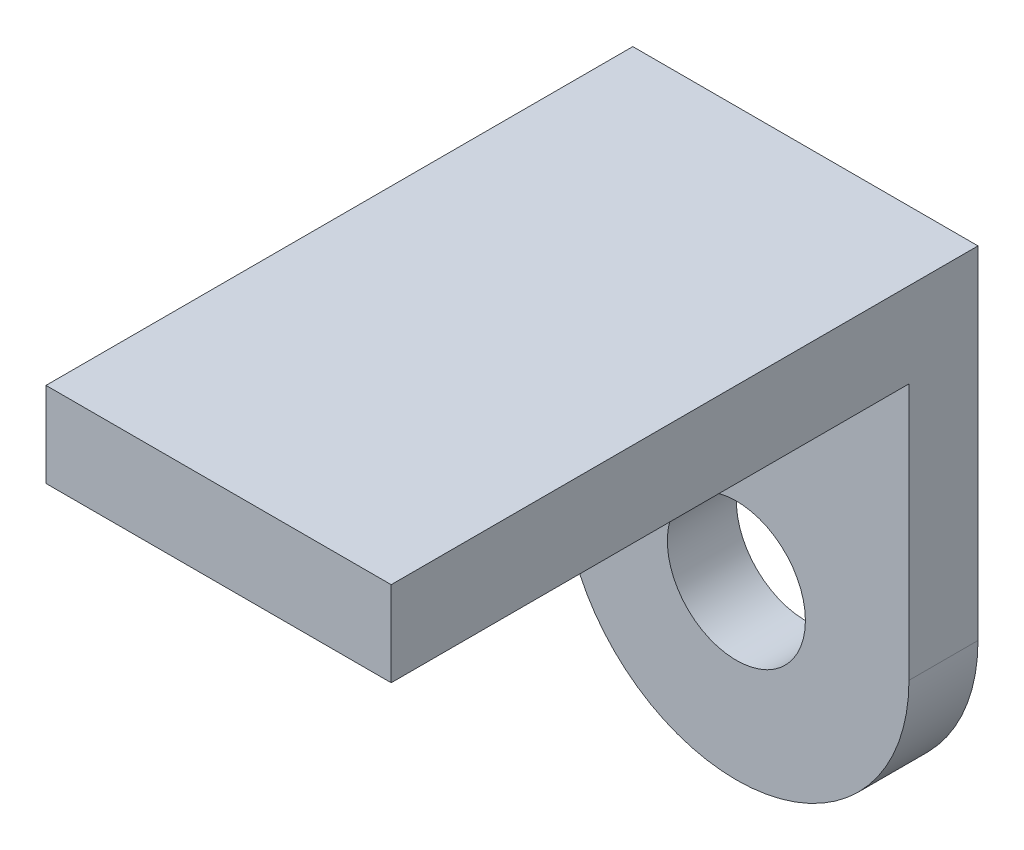
from build123d import *

# Parameters (mm, degrees)
SCHIZZO1_R                   = 2
ESTRUSIONE_ESTRUSIONE1_DEPTH = 2
SCHIZZO2_W                   = 10
SCHIZZO2_H                   = 2.461564046
ESTRUSIONE_ESTRUSIONE2_DEPTH = 15
SCHIZZO4_W                   = 0.358974359
SCHIZZO4_H                   = 1.346153846
ESTRUSIONE_ESTRUSIONE3_DEPTH = 0.2


with BuildPart() as part:
    # Schizzo1 → Estrusione-Estrusione1 (new body)
    with BuildSketch(Plane.XY):
        with BuildLine():
            Line((-5, 0), (-5, 9.9))
            Line((-5, 9.9), (5, 9.9))
            Line((5, 9.9), (5, 0))
            ThreePointArc((5, 0), (0, -5), (-5, 0))
        make_face()
        Circle(SCHIZZO1_R, mode=Mode.SUBTRACT)
    extrude(amount=ESTRUSIONE_ESTRUSIONE1_DEPTH)

    # Schizzo2 → Estrusione-Estrusione2 (add)
    with BuildSketch(Plane.XY.offset(2)):
        with Locations((0, 8.669217977)):
            Rectangle(SCHIZZO2_W, SCHIZZO2_H)
    extrude(amount=ESTRUSIONE_ESTRUSIONE2_DEPTH)

    # Schizzo4 → Estrusione-Estrusione3 (add)
    # profile 1 of 6: a face of its own
    with BuildSketch(Plane.XZ.offset(-7.438435954)):
        with BuildLine():
            Line((3.5, 16.320512821), (3.5, 15.634114583))
            add(Edge.make_bspline(
                [(3.5, 15.634114583), (3.499948104, 15.586903677), (3.499848668, 15.496445484), (3.496833922, 15.366730429), (3.49280723, 15.248920697), (3.487225337, 15.143270316), (3.480628747, 15.049454218), (3.471376708, 14.967896918), (3.461716412, 14.897957362), (3.451895005, 14.856050913), (3.447415865, 14.836939103)],
                knots=[0, 0, 0, 0, 1.415646017, 2.712440637, 3.8905458, 4.950247383, 5.884950622, 6.709939814, 7.411656543, 8, 8, 8, 8], degree=3))
            add(Edge.make_bspline(
                [(3.447415865, 14.836939103), (3.440793975, 14.812745512), (3.42770623, 14.764928422), (3.401491651, 14.696028205), (3.370412659, 14.630471292), (3.334976989, 14.568051074), (3.293734792, 14.509467066), (3.247990678, 14.453969355), (3.197769812, 14.401239622), (3.142098627, 14.35306908), (3.083029703, 14.308721911), (3.019247543, 14.270678768), (2.952140341, 14.238499291), (2.881020836, 14.212218459), (2.806321276, 14.192234889), (2.727823588, 14.177470397), (2.645797497, 14.168023892), (2.589736435, 14.167124508), (2.561197917, 14.166666667)],
                knots=[0, 0, 0, 0, 0.999487232, 1.975422798, 2.933948774, 3.889618007, 4.832992075, 5.786114792, 6.754729845, 7.731954186, 8.717668599, 9.695514499, 10.68728626, 11.680675814, 12.71351902, 13.766008651, 14.862761406, 16, 16, 16, 16], degree=3))
            add(Edge.make_bspline(
                [(2.561197917, 14.166666667), (2.53242014, 14.167088091), (2.476114476, 14.167912637), (2.393741688, 14.177808923), (2.315023298, 14.191139114), (2.240133847, 14.211636167), (2.169518077, 14.23848184), (2.102096845, 14.269973893), (2.039017173, 14.307957423), (1.980050055, 14.351602253), (1.925140143, 14.400153847), (1.874685348, 14.453406785), (1.82898101, 14.511146078), (1.787924666, 14.573188226), (1.752468387, 14.640138075), (1.720711082, 14.710980228), (1.694040021, 14.786330445), (1.68000996, 14.838472959), (1.672876603, 14.864983974)],
                knots=[0, 0, 0, 0, 1.121902311, 2.195077645, 3.232258892, 4.234102512, 5.217864754, 6.176164875, 7.132989551, 8.084763148, 9.034132444, 9.988522005, 10.94243251, 11.903244335, 12.886203696, 13.894208494, 14.929344452, 16, 16, 16, 16], degree=3))
            add(Edge.make_bspline(
                [(1.672876603, 14.864983974), (1.668213621, 14.886911308), (1.657994427, 14.934966336), (1.64658597, 15.014109058), (1.63684837, 15.106254444), (1.629547232, 15.211276724), (1.623296864, 15.329081629), (1.61832877, 15.459732886), (1.615598916, 15.603486963), (1.615458123, 15.703758207), (1.615384615, 15.756109776)],
                knots=[0, 0, 0, 0, 0.601384939, 1.31797006, 2.144135048, 3.087295005, 4.142315834, 5.309527816, 6.595305764, 8, 8, 8, 8], degree=3))
            Line((1.615384615, 15.756109776), (1.615384615, 16.006410256))
            Line((1.615384615, 16.006410256), (0, 16.006410256))
            Line((0, 16.006410256), (0, 16.320512821))
            Line((0, 16.320512821), (3.5, 16.320512821))
        make_face()
        with BuildLine():
            Line((3.141025641, 16.006410256), (1.974358974, 16.006410256))
            Line((1.974358974, 16.006410256), (1.966646635, 15.393629808))
            add(Edge.make_bspline(
                [(1.966646635, 15.393629808), (1.966627924, 15.363709589), (1.966591804, 15.305949225), (1.970631709, 15.222283895), (1.975087995, 15.144860897), (1.982066731, 15.073512095), (1.99126187, 15.008782741), (2.001270604, 14.949841409), (2.014830447, 14.897550968), (2.033737491, 14.836276146), (2.065355346, 14.76822905), (2.112432024, 14.694692519), (2.170792088, 14.631362577), (2.237310672, 14.576925738), (2.311578922, 14.534737331), (2.390418136, 14.503006271), (2.473877922, 14.48452311), (2.530961719, 14.482029031), (2.559795673, 14.480769231)],
                knots=[0, 0, 0, 0, 1.160368111, 2.240066715, 3.248291599, 4.168343349, 5.019594299, 5.784185847, 6.485545725, 7.113397927, 8.269509094, 9.383373363, 10.487084095, 11.595623793, 12.704274681, 13.786671823, 14.88201193, 16, 16, 16, 16], degree=3))
            add(Edge.make_bspline(
                [(2.559795673, 14.480769231), (2.587932, 14.482035758), (2.643863535, 14.484553458), (2.725874557, 14.503152064), (2.803877317, 14.534675389), (2.877231232, 14.577211613), (2.943477588, 14.630085397), (3.000520555, 14.692011888), (3.047000556, 14.761726588), (3.076793746, 14.826609774), (3.095014888, 14.884205845), (3.107758306, 14.934239045), (3.117934363, 14.990729327), (3.126173726, 15.053697228), (3.133227231, 15.122654024), (3.138013195, 15.198192351), (3.140814655, 15.28002599), (3.14095361, 15.336836562), (3.141025641, 15.366286058)],
                knots=[0, 0, 0, 0, 1.120550889, 2.227516482, 3.330715807, 4.461473166, 5.594337325, 6.694900473, 7.802844763, 8.919519911, 9.52614448, 10.208195984, 10.975273469, 11.811520316, 12.738076669, 13.736566072, 14.826679847, 16, 16, 16, 16], degree=3))
            Line((3.141025641, 15.366286058), (3.141025641, 16.006410256))
        make_face(mode=Mode.SUBTRACT)
    # profile 2 of 6: a face of its own
    with BuildSketch(Plane.XZ.offset(-7.438435954)):
        Polygon((3.141025641, 13.852564103), (3.5, 13.852564103), (3.5, 12.012820513), (3.141025641, 12.012820513), (3.141025641, 12.775641026), (0, 12.775641026), (0, 13.08974359), (3.141025641, 13.08974359), align=None)
    # profile 3 of 6: a face of its own
    with BuildSketch(Plane.XZ.offset(-7.438435954)):
        with Locations((1.346153847, 11.025641026)):
            Rectangle(SCHIZZO4_W, SCHIZZO4_H)
    # profile 4 of 6: a face of its own
    with BuildSketch(Plane.XZ.offset(-7.438435954)):
        with BuildLine():
            add(Edge.make_bspline(
                [(1.748597756, 10.083333333), (1.804695144, 10.083005315), (1.913665128, 10.082368135), (2.07244977, 10.075279714), (2.22141006, 10.063504373), (2.360553124, 10.047366997), (2.489914896, 10.027729025), (2.609149627, 10.00151351), (2.718809322, 9.971700804), (2.819251073, 9.937148033), (2.9118298, 9.898161364), (2.99825139, 9.855723155), (3.078406126, 9.80817236), (3.153498145, 9.758145399), (3.222689384, 9.703814153), (3.285848812, 9.645751683), (3.343014566, 9.583382033), (3.394867016, 9.517938733), (3.440037109, 9.449008199), (3.480738366, 9.378715329), (3.514144377, 9.305819749), (3.541593396, 9.23098629), (3.5635876, 9.154432576), (3.578818544, 9.075842292), (3.588364251, 8.995196451), (3.589279448, 8.940765628), (3.58974359, 8.913161058)],
                knots=[0, 0, 0, 0, 1.646377244, 3.198111528, 4.663803227, 6.031090796, 7.308794487, 8.502186765, 9.612154809, 10.642545331, 11.617106989, 12.558866172, 13.465886467, 14.35053239, 15.20542558, 16.045215227, 16.865619885, 17.686225247, 18.492864914, 19.282407821, 20.068097601, 20.842842034, 21.620163247, 22.403093475, 23.190129512, 24, 24, 24, 24], degree=3))
            add(Edge.make_bspline(
                [(3.58974359, 8.913161058), (3.589255775, 8.885325579), (3.588285664, 8.82996957), (3.578961721, 8.748129195), (3.563490598, 8.668179513), (3.541569623, 8.590461375), (3.514373947, 8.514336388), (3.48028683, 8.440399981), (3.440607962, 8.368192899), (3.393984085, 8.298862611), (3.342001809, 8.231647996), (3.28323914, 8.168200033), (3.218289421, 8.108512947), (3.147847557, 8.051837642), (3.070562472, 7.999782045), (2.987778362, 7.950208612), (2.898047497, 7.905836576), (2.80286703, 7.863101901), (2.699603371, 7.826214915), (2.58883861, 7.792948669), (2.469264423, 7.766069701), (2.341508178, 7.743680428), (2.205100695, 7.726335532), (2.060334379, 7.71370289), (1.907113989, 7.707029805), (1.80235614, 7.705773104), (1.748597756, 7.705128205)],
                knots=[0, 0, 0, 0, 0.810914788, 1.612654377, 2.396697861, 3.181598691, 3.963628158, 4.749916497, 5.551656086, 6.361998678, 7.18212741, 8.025565596, 8.878627764, 9.750805457, 10.657531673, 11.591944965, 12.560506719, 13.57287815, 14.630710178, 15.753379473, 16.941251878, 18.199788006, 19.531962791, 20.947069417, 22.433333509, 24, 24, 24, 24], degree=3))
            add(Edge.make_bspline(
                [(1.748597756, 7.705128205), (1.695074049, 7.705780595), (1.590785287, 7.70705175), (1.438251546, 7.713619331), (1.294263217, 7.726617051), (1.15841949, 7.74269318), (1.031526912, 7.765593404), (0.91237889, 7.791626923), (0.802003651, 7.823983793), (0.699284596, 7.860368008), (0.604570451, 7.902175383), (0.515615267, 7.946939586), (0.432898706, 7.996208726), (0.355614745, 8.048574771), (0.284561967, 8.104768343), (0.219564768, 8.164708169), (0.16066602, 8.228439871), (0.107973503, 8.295806452), (0.061892361, 8.366227402), (0.020703231, 8.438193466), (-0.012719194, 8.51314102), (-0.040938395, 8.589404416), (-0.062909799, 8.667703249), (-0.077953472, 8.747960718), (-0.088533415, 8.829913983), (-0.089338801, 8.885315949), (-0.08974359, 8.913161058)],
                knots=[0, 0, 0, 0, 1.56130642, 3.042141888, 4.451772327, 5.777565838, 7.030558081, 8.211376819, 9.333164717, 10.383253789, 11.387583522, 12.350962576, 13.286244149, 14.193812918, 15.072134482, 15.925989337, 16.770211267, 17.600669898, 18.417446232, 19.22325363, 20.01647746, 20.807971184, 21.593601364, 22.38506573, 23.188331689, 24, 24, 24, 24], degree=3))
            add(Edge.make_bspline(
                [(-0.08974359, 8.913161058), (-0.089274982, 8.940764506), (-0.088350978, 8.995193119), (-0.078869784, 9.075855157), (-0.063409151, 9.154322872), (-0.042413687, 9.230753126), (-0.015729699, 9.305302334), (0.018211346, 9.377240214), (0.057577679, 9.447516818), (0.102364248, 9.515811471), (0.153688491, 9.580822518), (0.210451579, 9.642922435), (0.274077246, 9.700543222), (0.343547066, 9.754193525), (0.418271588, 9.805104748), (0.498986903, 9.85218958), (0.586218212, 9.894545011), (0.679308003, 9.934405404), (0.780487951, 9.969542265), (0.890732526, 10.000345232), (1.010651574, 10.026023814), (1.139889093, 10.046674663), (1.278541811, 10.06369921), (1.426853853, 10.075223956), (1.58469726, 10.08237378), (1.69296729, 10.083007646), (1.748597756, 10.083333333)],
                knots=[0, 0, 0, 0, 0.810940842, 1.599017053, 2.38298203, 3.159479784, 3.926441347, 4.70693857, 5.494146311, 6.292334103, 7.104379492, 7.925868426, 8.762126819, 9.623561095, 10.503686106, 11.41783325, 12.366995289, 13.351843594, 14.392337808, 15.512229747, 16.713911458, 17.994391108, 19.357476964, 20.818259213, 22.365182633, 24, 24, 24, 24], degree=3))
        make_face()
        with BuildLine():
            add(Edge.make_bspline(
                [(1.75, 9.769230769), (1.703251301, 9.769111322), (1.612521256, 9.768879499), (1.480677996, 9.762823298), (1.357707666, 9.754573067), (1.243454132, 9.743931767), (1.138304111, 9.728128828), (1.041534456, 9.710422009), (0.953657127, 9.688874022), (0.874069619, 9.663378666), (0.801419519, 9.634340719), (0.733821907, 9.602630841), (0.670457219, 9.568584325), (0.611969031, 9.53041457), (0.557775133, 9.488987349), (0.508031265, 9.444234635), (0.462954472, 9.396235135), (0.409466486, 9.329788093), (0.353539978, 9.242497624), (0.30543891, 9.131950789), (0.275014831, 9.018309403), (0.271156555, 8.94115459), (0.269230769, 8.902644231)],
                knots=[0, 0, 0, 0, 1.459116078, 2.831857795, 4.118796693, 5.306371758, 6.412361096, 7.436813035, 8.376339383, 9.234574298, 10.043323891, 10.816788787, 11.564361537, 12.286735248, 12.994408768, 13.691741332, 14.372975427, 15.047457468, 16.352811911, 17.594285292, 18.799233213, 20, 20, 20, 20], degree=3))
            add(Edge.make_bspline(
                [(0.269230769, 8.902644231), (0.27082855, 8.863886559), (0.274020813, 8.786451236), (0.30481955, 8.673317441), (0.35128909, 8.563487171), (0.406236595, 8.47741523), (0.458564925, 8.411932687), (0.503179573, 8.365015697), (0.55313544, 8.321953648), (0.607034736, 8.281111574), (0.66590722, 8.243652498), (0.729469796, 8.20958936), (0.797898973, 8.178506013), (0.845668713, 8.160796967), (0.870092147, 8.151742788)],
                knots=[0, 0, 0, 0, 1.353760809, 2.704726607, 4.075137775, 5.516104923, 6.260822281, 7.007110065, 7.778089737, 8.566572457, 9.372053459, 10.217411131, 11.088608312, 12, 12, 12, 12], degree=3))
            add(Edge.make_bspline(
                [(0.870092147, 8.151742788), (0.901321887, 8.141191021), (0.964731651, 8.119766407), (1.063095303, 8.092154633), (1.166298067, 8.070409233), (1.273723184, 8.050845868), (1.386162885, 8.037492812), (1.503269269, 8.026744998), (1.625130631, 8.020414311), (1.707925622, 8.01962956), (1.75, 8.019230769)],
                knots=[0, 0, 0, 0, 0.884706709, 1.796334032, 2.740027952, 3.714592787, 4.726048262, 5.777819803, 6.87074269, 8, 8, 8, 8], degree=3))
            add(Edge.make_bspline(
                [(1.75, 8.019230769), (1.792073473, 8.019670593), (1.874388363, 8.020531089), (1.99481512, 8.026184628), (2.109394462, 8.035269394), (2.218230331, 8.047565425), (2.321129012, 8.064445276), (2.418237752, 8.084716297), (2.50953037, 8.108481743), (2.595242303, 8.135741418), (2.675065479, 8.166462694), (2.74917369, 8.200400493), (2.817959812, 8.236616723), (2.881226403, 8.27596035), (2.939259034, 8.317955684), (2.990893606, 8.363713322), (3.03773058, 8.411417672), (3.091193147, 8.478234865), (3.145704844, 8.565709151), (3.195870603, 8.6745548), (3.224678896, 8.787825444), (3.228740583, 8.864398898), (3.230769231, 8.902644231)],
                knots=[0, 0, 0, 0, 1.313668642, 2.570134578, 3.763346207, 4.902004944, 5.98888779, 7.017888835, 7.998425394, 8.933058446, 9.82474457, 10.667209444, 11.476765193, 12.250262638, 12.991704352, 13.7104269, 14.401925311, 15.076585796, 16.378385137, 17.609787933, 18.806186071, 20, 20, 20, 20], degree=3))
            add(Edge.make_bspline(
                [(3.230769231, 8.902644231), (3.228740401, 8.941356448), (3.224679046, 9.018851408), (3.195946146, 9.133274739), (3.146171898, 9.242895747), (3.090841129, 9.329668235), (3.038677018, 9.396401125), (2.993314909, 9.443523863), (2.943420558, 9.487578716), (2.889456104, 9.529040451), (2.830938416, 9.567173461), (2.767582943, 9.601233911), (2.699979049, 9.632925586), (2.627345478, 9.662025877), (2.547637987, 9.687284956), (2.460204166, 9.709861914), (2.363344124, 9.72755799), (2.257900132, 9.743000336), (2.143506144, 9.754774249), (2.020252311, 9.762802119), (1.888181051, 9.768890457), (1.796982876, 9.76911506), (1.75, 9.769230769)],
                knots=[0, 0, 0, 0, 1.207964612, 2.418129846, 3.655795183, 4.951004962, 5.620895151, 6.296795572, 6.989224116, 7.696855977, 8.419187164, 9.166715907, 9.940135271, 10.748837255, 11.607021648, 12.548275234, 13.5654991, 14.678641405, 15.874140913, 17.15372626, 18.533675393, 20, 20, 20, 20], degree=3))
        make_face(mode=Mode.SUBTRACT)
    # profile 5 of 6: a face of its own
    with BuildSketch(Plane.XZ.offset(-7.438435954)):
        with BuildLine():
            add(Edge.make_bspline(
                [(1.748597756, 7.391025641), (1.804695144, 7.390697623), (1.913665128, 7.390060443), (2.07244977, 7.382972022), (2.22141006, 7.37119668), (2.360553124, 7.355059305), (2.489914896, 7.335421333), (2.609149627, 7.309205818), (2.718809322, 7.279393112), (2.819251073, 7.244840341), (2.9118298, 7.205853671), (2.99825139, 7.163415462), (3.078406126, 7.115864668), (3.153498145, 7.065837706), (3.222689384, 7.011506461), (3.285848812, 6.953443991), (3.343014566, 6.891074341), (3.394867016, 6.82563104), (3.440037109, 6.756700506), (3.480738366, 6.686407637), (3.514144377, 6.613512057), (3.541593396, 6.538678598), (3.5635876, 6.462124883), (3.578818544, 6.383534599), (3.588364251, 6.302888759), (3.589279448, 6.248457935), (3.58974359, 6.220853365)],
                knots=[0, 0, 0, 0, 1.646377244, 3.198111528, 4.663803227, 6.031090796, 7.308794487, 8.502186765, 9.612154809, 10.642545331, 11.617106989, 12.558866172, 13.465886467, 14.35053239, 15.20542558, 16.045215227, 16.865619885, 17.686225247, 18.492864914, 19.282407821, 20.068097601, 20.842842034, 21.620163247, 22.403093475, 23.190129512, 24, 24, 24, 24], degree=3))
            add(Edge.make_bspline(
                [(3.58974359, 6.220853365), (3.589255775, 6.193017887), (3.588285664, 6.137661878), (3.578961721, 6.055821503), (3.563490598, 5.975871821), (3.541569623, 5.898153682), (3.514373947, 5.822028696), (3.48028683, 5.748092288), (3.440607962, 5.675885207), (3.393984085, 5.606554919), (3.342001809, 5.539340304), (3.28323914, 5.475892341), (3.218289421, 5.416205255), (3.147847557, 5.359529949), (3.070562472, 5.307474352), (2.987778362, 5.25790092), (2.898047497, 5.213528884), (2.80286703, 5.170794209), (2.699603371, 5.133907222), (2.58883861, 5.100640977), (2.469264423, 5.073762008), (2.341508178, 5.051372736), (2.205100695, 5.03402784), (2.060334379, 5.021395198), (1.907113989, 5.014722113), (1.80235614, 5.013465412), (1.748597756, 5.012820513)],
                knots=[0, 0, 0, 0, 0.810914788, 1.612654377, 2.396697861, 3.181598691, 3.963628158, 4.749916497, 5.551656086, 6.361998678, 7.18212741, 8.025565596, 8.878627764, 9.750805457, 10.657531673, 11.591944965, 12.560506719, 13.57287815, 14.630710178, 15.753379473, 16.941251878, 18.199788006, 19.531962791, 20.947069417, 22.433333509, 24, 24, 24, 24], degree=3))
            add(Edge.make_bspline(
                [(1.748597756, 5.012820513), (1.695074049, 5.013472903), (1.590785287, 5.014744058), (1.438251546, 5.021311638), (1.294263217, 5.034309359), (1.15841949, 5.050385488), (1.031526912, 5.073285712), (0.91237889, 5.099319231), (0.802003651, 5.1316761), (0.699284596, 5.168060316), (0.604570451, 5.209867691), (0.515615267, 5.254631893), (0.432898706, 5.303901034), (0.355614745, 5.356267079), (0.284561967, 5.412460651), (0.219564768, 5.472400477), (0.16066602, 5.536132179), (0.107973503, 5.603498759), (0.061892361, 5.67391971), (0.020703231, 5.745885773), (-0.012719194, 5.820833327), (-0.040938395, 5.897096723), (-0.062909799, 5.975395556), (-0.077953472, 6.055653025), (-0.088533415, 6.13760629), (-0.089338801, 6.193008257), (-0.08974359, 6.220853365)],
                knots=[0, 0, 0, 0, 1.56130642, 3.042141888, 4.451772327, 5.777565838, 7.030558081, 8.211376819, 9.333164717, 10.383253789, 11.387583522, 12.350962576, 13.286244149, 14.193812918, 15.072134482, 15.925989337, 16.770211267, 17.600669898, 18.417446232, 19.22325363, 20.01647746, 20.807971184, 21.593601364, 22.38506573, 23.188331689, 24, 24, 24, 24], degree=3))
            add(Edge.make_bspline(
                [(-0.08974359, 6.220853365), (-0.089274982, 6.248456814), (-0.088350978, 6.302885426), (-0.078869784, 6.383547465), (-0.063409151, 6.46201518), (-0.042413687, 6.538445433), (-0.015729699, 6.612994642), (0.018211346, 6.684932522), (0.057577679, 6.755209126), (0.102364248, 6.823503779), (0.153688491, 6.888514826), (0.210451579, 6.950614743), (0.274077246, 7.00823553), (0.343547066, 7.061885832), (0.418271588, 7.112797056), (0.498986903, 7.159881888), (0.586218212, 7.202237319), (0.679308003, 7.242097712), (0.780487951, 7.277234573), (0.890732526, 7.30803754), (1.010651574, 7.333716122), (1.139889093, 7.35436697), (1.278541811, 7.371391517), (1.426853853, 7.382916264), (1.58469726, 7.390066088), (1.69296729, 7.390699953), (1.748597756, 7.391025641)],
                knots=[0, 0, 0, 0, 0.810940842, 1.599017053, 2.38298203, 3.159479784, 3.926441347, 4.70693857, 5.494146311, 6.292334103, 7.104379492, 7.925868426, 8.762126819, 9.623561095, 10.503686106, 11.41783325, 12.366995289, 13.351843594, 14.392337808, 15.512229747, 16.713911458, 17.994391108, 19.357476964, 20.818259213, 22.365182633, 24, 24, 24, 24], degree=3))
        make_face()
        with BuildLine():
            add(Edge.make_bspline(
                [(1.75, 7.076923077), (1.703251301, 7.07680363), (1.612521256, 7.076571807), (1.480677996, 7.070515606), (1.357707666, 7.062265375), (1.243454132, 7.051624075), (1.138304111, 7.035821135), (1.041534456, 7.018114317), (0.953657127, 6.996566329), (0.874069619, 6.971070974), (0.801419519, 6.942033026), (0.733821907, 6.910323149), (0.670457219, 6.876276633), (0.611969031, 6.838106878), (0.557775133, 6.796679657), (0.508031265, 6.751926943), (0.462954472, 6.703927443), (0.409466486, 6.637480401), (0.353539978, 6.550189932), (0.30543891, 6.439643097), (0.275014831, 6.326001711), (0.271156555, 6.248846897), (0.269230769, 6.210336538)],
                knots=[0, 0, 0, 0, 1.459116078, 2.831857795, 4.118796693, 5.306371758, 6.412361096, 7.436813035, 8.376339383, 9.234574298, 10.043323891, 10.816788787, 11.564361537, 12.286735248, 12.994408768, 13.691741332, 14.372975427, 15.047457468, 16.352811911, 17.594285292, 18.799233213, 20, 20, 20, 20], degree=3))
            add(Edge.make_bspline(
                [(0.269230769, 6.210336538), (0.27082855, 6.171578867), (0.274020813, 6.094143544), (0.30481955, 5.981009748), (0.35128909, 5.871179478), (0.406236595, 5.785107538), (0.458564925, 5.719624995), (0.503179573, 5.672708005), (0.55313544, 5.629645956), (0.607034736, 5.588803881), (0.66590722, 5.551344806), (0.729469796, 5.517281668), (0.797898973, 5.48619832), (0.845668713, 5.468489274), (0.870092147, 5.459435096)],
                knots=[0, 0, 0, 0, 1.353760809, 2.704726607, 4.075137775, 5.516104923, 6.260822281, 7.007110065, 7.778089737, 8.566572457, 9.372053459, 10.217411131, 11.088608312, 12, 12, 12, 12], degree=3))
            add(Edge.make_bspline(
                [(0.870092147, 5.459435096), (0.901321887, 5.448883328), (0.964731651, 5.427458715), (1.063095303, 5.39984694), (1.166298067, 5.378101541), (1.273723184, 5.358538175), (1.386162885, 5.345185119), (1.503269269, 5.334437306), (1.625130631, 5.328106619), (1.707925622, 5.327321868), (1.75, 5.326923077)],
                knots=[0, 0, 0, 0, 0.884706709, 1.796334032, 2.740027952, 3.714592787, 4.726048262, 5.777819803, 6.87074269, 8, 8, 8, 8], degree=3))
            add(Edge.make_bspline(
                [(1.75, 5.326923077), (1.792073473, 5.327362901), (1.874388363, 5.328223397), (1.99481512, 5.333876935), (2.109394462, 5.342961701), (2.218230331, 5.355257733), (2.321129012, 5.372137583), (2.418237752, 5.392408604), (2.50953037, 5.41617405), (2.595242303, 5.443433725), (2.675065479, 5.474155002), (2.74917369, 5.508092801), (2.817959812, 5.54430903), (2.881226403, 5.583652657), (2.939259034, 5.625647991), (2.990893606, 5.671405629), (3.03773058, 5.71910998), (3.091193147, 5.785927173), (3.145704844, 5.873401459), (3.195870603, 5.982247107), (3.224678896, 6.095517751), (3.228740583, 6.172091206), (3.230769231, 6.210336538)],
                knots=[0, 0, 0, 0, 1.313668642, 2.570134578, 3.763346207, 4.902004944, 5.98888779, 7.017888835, 7.998425394, 8.933058446, 9.82474457, 10.667209444, 11.476765193, 12.250262638, 12.991704352, 13.7104269, 14.401925311, 15.076585796, 16.378385137, 17.609787933, 18.806186071, 20, 20, 20, 20], degree=3))
            add(Edge.make_bspline(
                [(3.230769231, 6.210336538), (3.228740401, 6.249048756), (3.224679046, 6.326543715), (3.195946146, 6.440967047), (3.146171898, 6.550588054), (3.090841129, 6.637360543), (3.038677018, 6.704093433), (2.993314909, 6.75121617), (2.943420558, 6.795271023), (2.889456104, 6.836732758), (2.830938416, 6.874865769), (2.767582943, 6.908926218), (2.699979049, 6.940617894), (2.627345478, 6.969718184), (2.547637987, 6.994977264), (2.460204166, 7.017554222), (2.363344124, 7.035250298), (2.257900132, 7.050692644), (2.143506144, 7.062466557), (2.020252311, 7.070494427), (1.888181051, 7.076582764), (1.796982876, 7.076807367), (1.75, 7.076923077)],
                knots=[0, 0, 0, 0, 1.207964612, 2.418129846, 3.655795183, 4.951004962, 5.620895151, 6.296795572, 6.989224116, 7.696855977, 8.419187164, 9.166715907, 9.940135271, 10.748837255, 11.607021648, 12.548275234, 13.5654991, 14.678641405, 15.874140913, 17.15372626, 18.533675393, 20, 20, 20, 20], degree=3))
        make_face(mode=Mode.SUBTRACT)
    # profile 6 of 6: a face of its own
    with BuildSketch(Plane.XZ.offset(-7.438435954)):
        with BuildLine():
            Line((2.692307692, 4.25), (2.692307692, 4.564102564))
            add(Edge.make_bspline(
                [(2.692307692, 4.564102564), (2.727540176, 4.555593013), (2.796416801, 4.538957538), (2.894824062, 4.504259964), (2.987947583, 4.466460709), (3.074043657, 4.421071605), (3.154842559, 4.37156285), (3.228511684, 4.314840129), (3.296924649, 4.253520406), (3.357637887, 4.185695457), (3.412615616, 4.114566795), (3.459490673, 4.039132176), (3.499814826, 3.960909282), (3.533035058, 3.879356149), (3.558060582, 3.794229977), (3.576217387, 3.706300354), (3.588008502, 3.615336854), (3.589159265, 3.553589263), (3.58974359, 3.522235577)],
                knots=[0, 0, 0, 0, 1.162005537, 2.271625781, 3.343758855, 4.383309926, 5.390229558, 6.379919256, 7.361854164, 8.333198761, 9.295911338, 10.242430842, 11.177959212, 12.116337295, 13.062827104, 14.020064771, 14.994644689, 16, 16, 16, 16], degree=3))
            add(Edge.make_bspline(
                [(3.58974359, 3.522235577), (3.588364359, 3.476552835), (3.585635984, 3.386183824), (3.560721548, 3.253420777), (3.521296415, 3.125393958), (3.466822688, 3.00350471), (3.399635375, 2.890286277), (3.319670638, 2.789550091), (3.228471337, 2.70266158), (3.127738772, 2.629767202), (3.020083263, 2.572692203), (2.909283106, 2.53060583), (2.795601134, 2.504984149), (2.718843855, 2.501663592), (2.680388622, 2.5)],
                knots=[0, 0, 0, 0, 1.083050992, 2.142477498, 3.193116406, 4.255571735, 5.30263384, 6.308962982, 7.297363603, 8.282367274, 9.249857812, 10.179914175, 11.08814088, 12, 12, 12, 12], degree=3))
            add(Edge.make_bspline(
                [(2.680388622, 2.5), (2.643381827, 2.501163591), (2.570965273, 2.503440558), (2.465243775, 2.522774264), (2.365602175, 2.555310527), (2.271621013, 2.600380289), (2.183896173, 2.658721839), (2.102230282, 2.729394536), (2.026261124, 2.812897198), (1.982741651, 2.876176136), (1.960336538, 2.908754006)],
                knots=[0, 0, 0, 0, 1.024540389, 2.004866551, 2.965041327, 3.920577974, 4.882998113, 5.874504559, 6.905732034, 8, 8, 8, 8], degree=3))
            add(Edge.make_bspline(
                [(1.960336538, 2.908754006), (1.942358367, 2.871522252), (1.906738409, 2.797755378), (1.836882652, 2.697204848), (1.756226304, 2.605926973), (1.693283652, 2.555023254), (1.661658654, 2.529447115)],
                knots=[0, 0, 0, 0, 1.015518401, 2.012035669, 3.001164323, 4, 4, 4, 4], degree=3))
            add(Edge.make_bspline(
                [(1.661658654, 2.529447115), (1.63860336, 2.512598918), (1.592870317, 2.479178423), (1.519297992, 2.438043043), (1.44515376, 2.400298559), (1.367522367, 2.372519711), (1.28889747, 2.348547666), (1.207595395, 2.332774859), (1.124388581, 2.322649348), (1.068071876, 2.321227519), (1.039763622, 2.320512821)],
                knots=[0, 0, 0, 0, 1.02516404, 2.033540309, 3.025129118, 4.011046665, 4.991655828, 5.976607087, 6.982917762, 8, 8, 8, 8], degree=3))
            add(Edge.make_bspline(
                [(1.039763622, 2.320512821), (0.990755849, 2.322311286), (0.892970936, 2.325899752), (0.748466982, 2.357844555), (0.607456243, 2.407653298), (0.472028038, 2.477149167), (0.345581461, 2.563133812), (0.232959431, 2.665996818), (0.135500517, 2.783237602), (0.054333869, 2.914088846), (-0.010595947, 3.05579353), (-0.055650154, 3.207372508), (-0.084997035, 3.36662164), (-0.088143782, 3.475829065), (-0.08974359, 3.53135016)],
                knots=[0, 0, 0, 0, 0.95570045, 1.906903359, 2.87519758, 3.868912786, 4.869932978, 5.851730567, 6.836639976, 7.83677598, 8.849487602, 9.869908895, 10.917060885, 12, 12, 12, 12], degree=3))
            add(Edge.make_bspline(
                [(-0.08974359, 3.53135016), (-0.088875376, 3.568769461), (-0.087167022, 3.642398166), (-0.075488421, 3.750641664), (-0.054158416, 3.853963363), (-0.025455111, 3.952502961), (0.010936632, 4.046347998), (0.05625533, 4.135212103), (0.109566832, 4.219641996), (0.171500419, 4.298840947), (0.240781759, 4.372799515), (0.318640769, 4.439552239), (0.403638173, 4.500212032), (0.496761229, 4.553154671), (0.596806487, 4.600791624), (0.705054985, 4.63997258), (0.820539007, 4.674458149), (0.901016747, 4.690491613), (0.942307692, 4.698717949)],
                knots=[0, 0, 0, 0, 1.048658725, 2.063410685, 3.046034179, 4.001477787, 4.936774919, 5.862367409, 6.792675028, 7.730719943, 8.675894397, 9.627829632, 10.600096036, 11.597688215, 12.626045268, 13.701542398, 14.82072376, 16, 16, 16, 16], degree=3))
            Line((0.942307692, 4.698717949), (0.942307692, 4.384615385))
            add(Edge.make_bspline(
                [(0.942307692, 4.384615385), (0.915358679, 4.376432093), (0.862940507, 4.360514881), (0.787500202, 4.333420582), (0.718342149, 4.30255231), (0.654959027, 4.269437752), (0.596726624, 4.234659306), (0.545184755, 4.195744381), (0.498069553, 4.155575235), (0.471524941, 4.125295882), (0.458533654, 4.110476763)],
                knots=[0, 0, 0, 0, 1.198163088, 2.33053128, 3.407730985, 4.417276592, 5.372219308, 6.28897303, 7.162600585, 8, 8, 8, 8], degree=3))
            add(Edge.make_bspline(
                [(0.458533654, 4.110476763), (0.44342532, 4.090880186), (0.413255288, 4.051747523), (0.37475366, 3.987979292), (0.341392634, 3.920914406), (0.315908939, 3.849099732), (0.294331278, 3.774084962), (0.280210759, 3.694657596), (0.270522587, 3.611518379), (0.269667656, 3.554750616), (0.269230769, 3.525741186)],
                knots=[0, 0, 0, 0, 0.946170439, 1.889420265, 2.845303464, 3.807233317, 4.801018734, 5.828864929, 6.890507805, 8, 8, 8, 8], degree=3))
            add(Edge.make_bspline(
                [(0.269230769, 3.525741186), (0.269845673, 3.49298724), (0.271048064, 3.428939726), (0.282137765, 3.335491061), (0.298218177, 3.246561481), (0.323371068, 3.163058512), (0.353546115, 3.083845884), (0.393050791, 3.010691852), (0.437664935, 2.941445776), (0.489559766, 2.878136248), (0.545652461, 2.821059612), (0.605161811, 2.771739093), (0.66624264, 2.729021883), (0.730319839, 2.694684375), (0.796764863, 2.667521794), (0.865826417, 2.649041805), (0.936922958, 2.636189435), (0.985252025, 2.635142938), (1.009615385, 2.634615385)],
                knots=[0, 0, 0, 0, 1.216990249, 2.379719373, 3.493992396, 4.571561497, 5.616923107, 6.638958652, 7.655775068, 8.674704564, 9.676001865, 10.625896028, 11.54399481, 12.441854662, 13.322657739, 14.20572845, 15.095482574, 16, 16, 16, 16], degree=3))
            add(Edge.make_bspline(
                [(1.009615385, 2.634615385), (1.04222676, 2.636145659), (1.107287242, 2.639198593), (1.203004264, 2.66250758), (1.29522983, 2.700844856), (1.382377184, 2.754523587), (1.463185343, 2.819835533), (1.535003987, 2.896148476), (1.594860686, 2.983649614), (1.636063792, 3.06470229), (1.66352393, 3.136669294), (1.682778465, 3.198134833), (1.698170198, 3.267008249), (1.71305864, 3.342462732), (1.725540165, 3.424816509), (1.735993931, 3.514143778), (1.744345446, 3.610480475), (1.748077047, 3.677171507), (1.75, 3.711538462)],
                knots=[0, 0, 0, 0, 1.070481957, 2.135637345, 3.216366529, 4.339485895, 5.485746587, 6.620975969, 7.768829582, 8.956804399, 9.598399438, 10.297751078, 11.070570279, 11.915248466, 12.824061284, 13.805856426, 14.869322739, 16, 16, 16, 16], degree=3))
            Line((1.75, 3.711538462), (2.108974359, 3.711538462))
            add(Edge.make_bspline(
                [(2.108974359, 3.711538462), (2.109712367, 3.668238493), (2.111157942, 3.58342449), (2.128520852, 3.459513338), (2.152809279, 3.340883056), (2.189153679, 3.230241513), (2.232777333, 3.129724504), (2.281966189, 3.042039155), (2.337694955, 2.969263574), (2.399232246, 2.911215938), (2.466002421, 2.868611034), (2.534865919, 2.836631834), (2.607424963, 2.817884331), (2.656914947, 2.815367592), (2.681790865, 2.814102564)],
                knots=[0, 0, 0, 0, 1.321708579, 2.588902423, 3.815526512, 5.016621128, 6.138757764, 7.158873101, 8.079948563, 8.928590313, 9.728601868, 10.489025425, 11.240515403, 12, 12, 12, 12], degree=3))
            add(Edge.make_bspline(
                [(2.681790865, 2.814102564), (2.700068654, 2.814516927), (2.736431449, 2.815341282), (2.789555873, 2.825739267), (2.841059226, 2.841360666), (2.890707816, 2.862850519), (2.938213459, 2.891561883), (2.983634437, 2.926025084), (3.027731957, 2.966256757), (3.06839634, 3.013308354), (3.106753266, 3.064246727), (3.139911402, 3.119551172), (3.168016216, 3.178001883), (3.191236783, 3.23965261), (3.208693025, 3.304750323), (3.22122972, 3.37297627), (3.229067137, 3.444464123), (3.230195586, 3.493235832), (3.230769231, 3.518028846)],
                knots=[0, 0, 0, 0, 0.884317272, 1.759307272, 2.611736065, 3.488921043, 4.37244062, 5.294096728, 6.247679003, 7.258495569, 8.302441962, 9.333537773, 10.376747089, 11.440883505, 12.520330301, 13.637364711, 14.798958396, 16, 16, 16, 16], degree=3))
            add(Edge.make_bspline(
                [(3.230769231, 3.518028846), (3.229380568, 3.557881831), (3.226668186, 3.63572398), (3.202827569, 3.747920548), (3.165054571, 3.852114776), (3.119443787, 3.931489759), (3.074574995, 3.990202504), (3.035974373, 4.032962475), (2.992209174, 4.074187468), (2.942078968, 4.112259775), (2.887307529, 4.149460771), (2.827593197, 4.185435242), (2.762084624, 4.219027686), (2.716017108, 4.239475957), (2.692307692, 4.25)],
                knots=[0, 0, 0, 0, 1.4727372, 2.876598283, 4.222346151, 5.558423782, 6.24313385, 6.953189256, 7.68715613, 8.463578749, 9.278833271, 10.135787152, 11.040551781, 12, 12, 12, 12], degree=3))
        make_face()
    extrude(amount=ESTRUSIONE_ESTRUSIONE3_DEPTH)


solid = part.part
